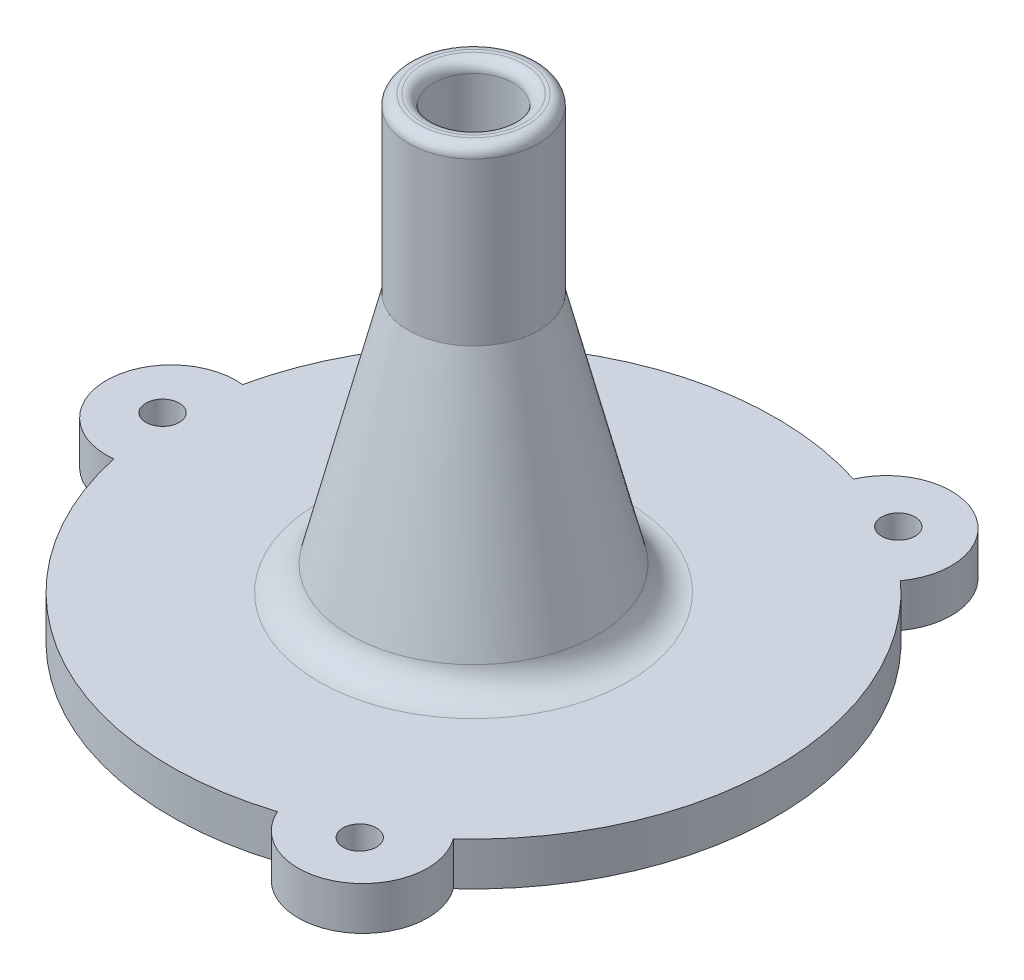
from build123d import *

# Parameters (mm, degrees)
SKETCH1_R            = 28
BOSS_EXTRUDE1_DEPTH  = 4
SKETCH2_R            = 6
BOSS_EXTRUDE3_DEPTH  = 4
SKETCH3_R            = 1.55
CUT_EXTRUDE1_DEPTH   = 46.683525867
SKETCH4_R            = 8.8
CUT_EXTRUDE2_DEPTH   = 46.683525867
SKETCH5_R            = 12
BOSS_EXTRUDE4_DEPTH  = 24
BOSS_EXTRUDE4_TAPER  = 14
FILLET1_R            = 3
FILLET2_R            = 3
SKETCH17_R           = 8.8
CUT_EXTRUDE4_DEPTH   = 24
CUT_EXTRUDE4_DRAFT   = -12
SKETCH19_R           = 6.01633814
SKETCH19_R_2         = 3.69864252
BOSS_EXTRUDE10_DEPTH = 16
FILLET3_R            = 1


with BuildPart() as part:
    # Sketch1 → Boss-Extrude1 (new body)
    with BuildSketch(Plane(origin=(0, 0, 0), x_dir=(1, 0, 0), z_dir=(0, 1, 0))):
        with Locations(Location((0, 0, 0), (0, 0, 270))):
            Circle(SKETCH1_R)
    extrude(amount=BOSS_EXTRUDE1_DEPTH)

    # Sketch2 → Boss-Extrude3 (add)
    with BuildSketch(Plane(origin=(0, 4, 0), x_dir=(1, 0, 0), z_dir=(0, 1, 0))):
        with Locations((-28, 0)):
            Circle(SKETCH2_R)
        with Locations((14, 24.248711306)):
            Circle(SKETCH2_R)
        with Locations((14, -24.248711306)):
            Circle(SKETCH2_R)
    extrude(amount=-BOSS_EXTRUDE3_DEPTH)

    # Sketch3 → Cut-Extrude1 (cut, through all)
    with BuildSketch(Plane(origin=(0, 4, 0), x_dir=(1, 0, 0), z_dir=(0, 1, 0))):
        with Locations(Location((-28.8, 0, 0), (0, 0, 270))):
            Circle(SKETCH3_R)
        with Locations(Location((14.4, 24.941531629, 0), (0, 0, 270))):
            Circle(SKETCH3_R)
        with Locations(Location((14.4, -24.941531629, 0), (0, 0, 270))):
            Circle(SKETCH3_R)
    extrude(amount=-CUT_EXTRUDE1_DEPTH, mode=Mode.SUBTRACT)

    # Sketch4 → Cut-Extrude2 (cut, through all)
    with BuildSketch(Plane(origin=(0, 4, 0), x_dir=(1, 0, 0), z_dir=(0, 1, 0))):
        with Locations(Location((0, 0, 0), (0, 0, 270))):
            Circle(SKETCH4_R)
    extrude(amount=-CUT_EXTRUDE2_DEPTH, mode=Mode.SUBTRACT)

    # Sketch5 → Boss-Extrude4 (add)
    with BuildSketch(Plane(origin=(0, 4, 0), x_dir=(1, 0, 0), z_dir=(0, 1, 0))):
        with Locations((-0.000210208, 0)):
            Circle(SKETCH5_R)
    extrude(amount=BOSS_EXTRUDE4_DEPTH, taper=BOSS_EXTRUDE4_TAPER)

    # Fillet1
    fillet1_edges = [part.edges().sort_by_distance(p)[0] for p in [
        (0, 0, -8.8),
    ]]
    fillet(fillet1_edges, radius=FILLET1_R)

    # Fillet2
    fillet2_edges = [part.edges().sort_by_distance(p)[0] for p in [
        (-12.000210208, 4, 0),
    ]]
    fillet(fillet2_edges, radius=FILLET2_R)


with BuildPart() as cut_extrude4_tool:
    # Sketch17 → Cut-Extrude4 (with draft: the straight prism first)
    with BuildSketch(Plane(origin=(0, 4, 0), x_dir=(-1, 0, 0), z_dir=(0, -1, 0))):
        with Locations(Location((0, 0, 0), (0, 0, 270))):
            Circle(SKETCH17_R)
    extrude(amount=-CUT_EXTRUDE4_DEPTH)
    # Cut-Extrude4: the draft: its side faces are tilted about the plane it starts from
    cut_extrude4_sides = [cut_extrude4_tool.faces().sort_by_distance(p)[0] for p in [
        (0, 16, -8.8),
    ]]
    draft(cut_extrude4_sides, Plane(origin=(0, 4, 0), x_dir=(-1, 0, 0), z_dir=(0, -1, 0)), CUT_EXTRUDE4_DRAFT)


with BuildPart() as part_1:
    add(part.part)

    # Cut-Extrude4: cut by cut_extrude4_tool
    add(cut_extrude4_tool.part, mode=Mode.SUBTRACT)

    # Sketch19 → Boss-Extrude10 (add)
    with BuildSketch(Plane(origin=(0, 28, 0), x_dir=(1, 0, 0), z_dir=(0, 1, 0))):
        with Locations(Location((0, 0, 0), (0, 0, 270))):
            Circle(SKETCH19_R)
        with Locations(Location((0, 0, 0), (0, 0, 90))):
            Circle(SKETCH19_R_2, mode=Mode.SUBTRACT)
    extrude(amount=BOSS_EXTRUDE10_DEPTH)

    # Fillet3
    fillet3_edges = [part_1.edges().sort_by_distance(p)[0] for p in [
        (0, 44, -6.01633814),
        (0, 44, 3.69864252),
    ]]
    fillet(fillet3_edges, radius=FILLET3_R)


solid = part_1.part
